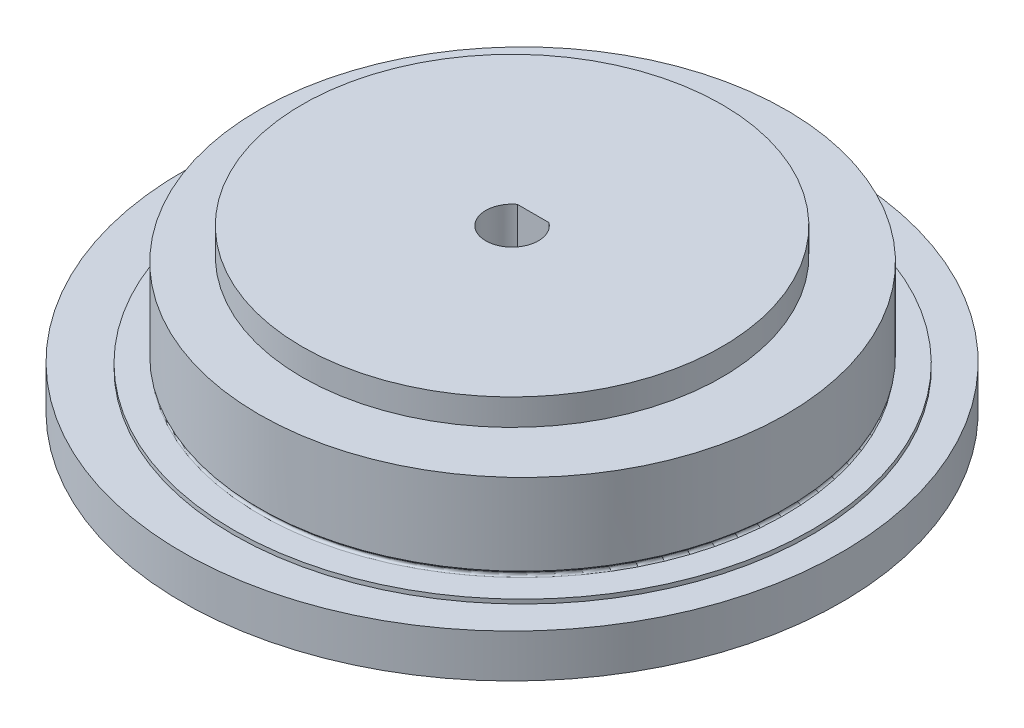
from build123d import *

# Parameters (mm, degrees)
SKETCH1_R                      = 25
BOSS_EXTRUDE1_DEPTH            = 10.8
BOSS_EXTRUDE2_START            = 2
SKETCH2_R                      = 31.25
BOSS_EXTRUDE2_DEPTH            = 2
BOSS_EXTRUDE3_START            = 2.5
SKETCH3_R                      = 31.25
SKETCH3_R_2                    = 30.1
SKETCH3_R_3                    = 19.9
BOSS_EXTRUDE3_DEPTH            = 2.5
CUT_EXTRUDE1_START             = -0.4
SKETCH4_R                      = 31.25
SKETCH4_R_2                    = 27.4
CUT_EXTRUDE1_DEPTH             = 0.4
CUT_EXTRUDE2_START             = -2.5
SKETCH5_R                      = 25
SKETCH5_R_2                    = 19.9
CUT_EXTRUDE2_DEPTH             = 2.5
FILLET1_R                      = 0.2
CUT_EXTRUDE3_REACH             = 67.733
SKETCH7_R                      = 2.15
CUT_EXTRUDE3_DIRECTION_2_DEPTH = 66.732526195
CUT_EXTRUDE4_DEPTH             = 66.732526212
CUT_EXTRUDE4_DEPTH_BACK        = 16
SKETCH8_R                      = 4.15


with BuildPart() as part:
    # Sketch1 → Boss-Extrude1 (new body)
    with BuildSketch(Plane(origin=(0, 0, 0), x_dir=(1, 0, 0), z_dir=(0, 1, 0))):
        with Locations(Location((0, 0, 0), (0, 0, 90))):
            Circle(SKETCH1_R)
        with BuildLine():
            Line((-2.5, 2), (0.5, 2))
            ThreePointArc((0.5, 2), (-1, -2.5), (-2.5, 2))
        make_face(mode=Mode.SUBTRACT)
    extrude(amount=BOSS_EXTRUDE1_DEPTH)

    # Sketch2 → Boss-Extrude2 (add)
    with BuildSketch(Plane.XZ.offset(BOSS_EXTRUDE2_START)):
        with Locations(Location((-1, 0, 0), (0, 0, 270))):
            Circle(SKETCH2_R)
        with BuildLine():
            Line((0.5, -2), (-2.5, -2))
            ThreePointArc((-2.5, -2), (-1, 2.5), (0.5, -2))
        make_face(mode=Mode.SUBTRACT)
    extrude(amount=-BOSS_EXTRUDE2_DEPTH)

    # Sketch3 → Boss-Extrude3 (add)
    # profile 1 of 2: a face of its own
    with BuildSketch(Plane.XZ.offset(2).offset(BOSS_EXTRUDE3_START)):
        with Locations(Location((-1, 0, 0), (0, 0, 270))):
            Circle(SKETCH3_R)
        with Locations(Location((-1, 0, 0), (0, 0, 270))):
            Circle(SKETCH3_R_2, mode=Mode.SUBTRACT)
    # profile 2 of 2: a face of its own
    with BuildSketch(Plane.XZ.offset(2).offset(BOSS_EXTRUDE3_START)):
        with Locations(Location((-1, 0, 0), (0, 0, 270))):
            Circle(SKETCH3_R_3)
        with BuildLine():
            Line((0.5, -2), (-2.5, -2))
            ThreePointArc((-2.5, -2), (-1, 2.5), (0.5, -2))
        make_face(mode=Mode.SUBTRACT)
    extrude(amount=-BOSS_EXTRUDE3_DEPTH)

    # Sketch4 → Cut-Extrude1 (cut)
    with BuildSketch(Plane(origin=(0, 0, 0), x_dir=(1, 0, 0), z_dir=(0, 1, 0)).offset(CUT_EXTRUDE1_START)):
        with Locations(Location((-1, 0, 0), (0, 0, 270))):
            Circle(SKETCH4_R)
        with Locations(Location((0, 0, 0), (0, 0, 270))):
            Circle(SKETCH4_R_2, mode=Mode.SUBTRACT)
    extrude(amount=CUT_EXTRUDE1_DEPTH, mode=Mode.SUBTRACT)

    # Sketch5 → Cut-Extrude2 (cut)
    with BuildSketch(Plane(origin=(0, 10.8, 0), x_dir=(1, 0, 0), z_dir=(0, 1, 0)).offset(CUT_EXTRUDE2_START)):
        with Locations(Location((0, 0, 0), (0, 0, 90))):
            Circle(SKETCH5_R)
        with Locations(Location((-1, 0, 0), (0, 0, 90))):
            Circle(SKETCH5_R_2, mode=Mode.SUBTRACT)
    extrude(amount=CUT_EXTRUDE2_DEPTH, mode=Mode.SUBTRACT)

    # Sketch6 → Cut-Revolve1 (revolve, cut)
    with BuildSketch(Plane.XY, mode=Mode.PRIVATE) as cut_revolve1_sk:
        Polygon((-25, 0), (-25, 0.6), (-24.4, 0), align=None)
    revolve(cut_revolve1_sk.sketch.rotate(Axis((0, 8.3, 0), (0, -1, 0)), 90), axis=Axis((0, 8.3, 0), (0, -1, 0)), mode=Mode.SUBTRACT)

    # Fillet1
    fillet1_edges = [part.edges().sort_by_distance(p)[0] for p in [
        (0, 0, 24.4),
    ]]
    fillet(fillet1_edges, radius=FILLET1_R)

    # Sketch7 → Cut-Extrude3 (cut, up to next)
    with BuildSketch(Plane(origin=(0, 0, -25), x_dir=(-1, 0, 0), z_dir=(0, 0, -1)), mode=Mode.PRIVATE) as cut_extrude3_sk1:
        with Locations((1, 3.15)):
            Circle(SKETCH7_R)
    cut_extrude3_tool1 = extrude(cut_extrude3_sk1.sketch, amount=-CUT_EXTRUDE3_REACH, mode=Mode.PRIVATE) & part.part
    add(cut_extrude3_tool1.solids().sort_by_distance((-1, 3.15, -25))[0], mode=Mode.SUBTRACT)

    # Sketch7 → Cut-Extrude3 direction 2 (cut)
    with BuildSketch(Plane(origin=(0, 0, -25), x_dir=(-1, 0, 0), z_dir=(0, 0, -1))):
        with Locations((1, 3.15)):
            Circle(SKETCH7_R)
    extrude(amount=CUT_EXTRUDE3_DIRECTION_2_DEPTH, mode=Mode.SUBTRACT)

    # Sketch8 → Cut-Extrude4 (cut, two sides: drawn at the far end of the back side and taken through both)
    with BuildSketch(Plane(origin=(0, 0, -25), x_dir=(-1, 0, 0), z_dir=(0, 0, -1)).offset(-CUT_EXTRUDE4_DEPTH_BACK)):
        with Locations(Location((1, 3.15, 0), (0, 0, 217.912535811))):
            Circle(SKETCH8_R)
    extrude(amount=CUT_EXTRUDE4_DEPTH + CUT_EXTRUDE4_DEPTH_BACK, mode=Mode.SUBTRACT)


solid = part.part
